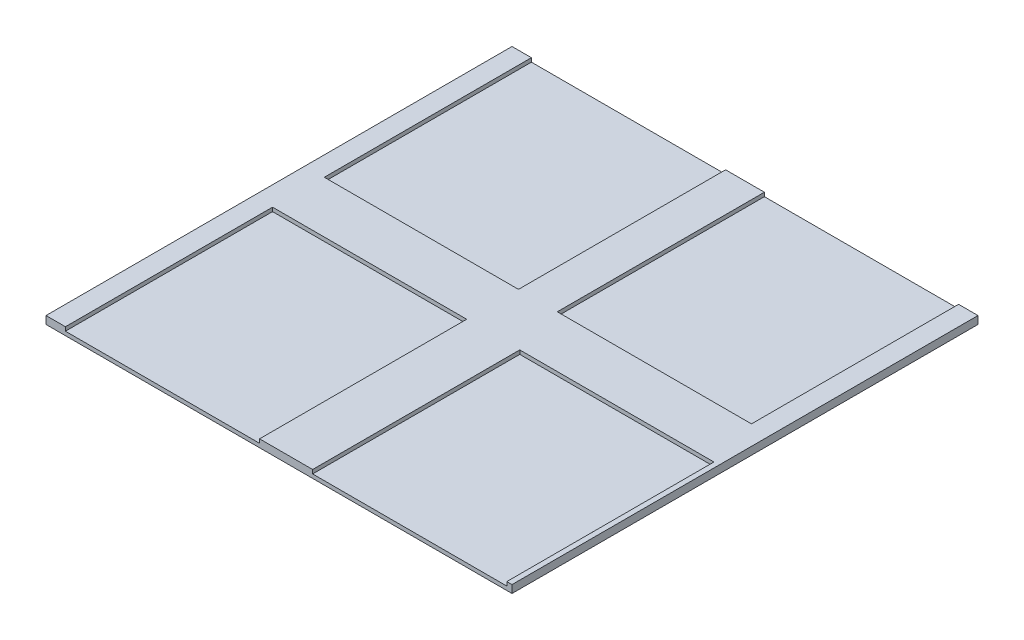
from build123d import *

# Parameters (mm, degrees)
SKETCH_1_W          = 360
SKETCH_1_H          = 360
EXTRUDE_1_DEPTH     = 6
SKETCH_2_W          = 140
SKETCH_2_H          = 140
CUT_EXTRUDE_1_DEPTH = 3
SKETCH_7_W          = 140
SKETCH_7_H          = 169.149624319
CUT_EXTRUDE_2_DEPTH = 110
SKETCH_4_R          = 42.212172728
EXTRUDE_2_DEPTH     = 1
SKETCH_10_W         = 6
SKETCH_10_H         = 160
CUT_EXTRUDE_3_DEPTH = 3
SKETCH_11_W         = 6
SKETCH_11_H         = 160
EXTRUDE_3_DEPTH     = 3
SKETCH_12_W         = 14
SKETCH_12_H         = 160
CUT_EXTRUDE_4_DEPTH = 3
SKETCH_13_W         = 14
SKETCH_13_H         = 160
EXTRUDE_4_DEPTH     = 3
SKETCH_14_W         = 4
SKETCH_14_H         = 160
EXTRUDE_5_DEPTH     = 3
SKETCH_15_W         = 4
SKETCH_15_H         = 160
CUT_EXTRUDE_5_DEPTH = 3
CUT_EXTRUDE_6_DEPTH = 3
SKETCH_17_W         = 150
SKETCH_17_H         = 165.602098182
CUT_EXTRUDE_7_DEPTH = 3


with BuildPart() as part:
    # 草图1 → 凸台-拉伸1 (new body)
    with BuildSketch(Plane(origin=(0, 0, 0), x_dir=(1, 0, 0), z_dir=(0, 1, 0))):
        Rectangle(SKETCH_1_W, SKETCH_1_H)
    extrude(amount=EXTRUDE_1_DEPTH)

    # 草图2 → 切除-拉伸1 (cut)
    with BuildSketch(Plane(origin=(0, 6, 0), x_dir=(1, 0, 0), z_dir=(0, 1, 0))):
        with Locations((-90, -90)):
            Rectangle(SKETCH_2_W, SKETCH_2_H)
        with Locations((90, -90)):
            Rectangle(SKETCH_2_W, SKETCH_2_H)
        with Locations((90, 90)):
            Rectangle(SKETCH_2_W, SKETCH_2_H)
        with Locations((-90, 90)):
            Rectangle(SKETCH_2_W, SKETCH_2_H)
    extrude(amount=-CUT_EXTRUDE_1_DEPTH, mode=Mode.SUBTRACT)

    # 草图7 → 切除-拉伸2 (cut)
    with BuildSketch(Plane(origin=(0, 3, 0), x_dir=(1, 0, 0), z_dir=(0, 1, 0))):
        with Locations((90, -104.57481216)):
            Rectangle(SKETCH_7_W, SKETCH_7_H)
        with Locations((-90, -104.57481216)):
            Rectangle(SKETCH_7_W, SKETCH_7_H)
        with Locations((90, 104.57481216)):
            Rectangle(SKETCH_7_W, SKETCH_7_H)
        with Locations((-90, 104.57481216)):
            Rectangle(SKETCH_7_W, SKETCH_7_H)
    extrude(amount=CUT_EXTRUDE_2_DEPTH, mode=Mode.SUBTRACT)

    # 草图4 → 凸台-拉伸2 (add)
    with BuildSketch(Plane.XZ):
        with Locations(Location((0, 0, 0), (0, 0, 270))):
            Circle(SKETCH_4_R)
    extrude(amount=EXTRUDE_2_DEPTH)

    # 草图10 → 切除-拉伸3 (cut)
    with BuildSketch(Plane(origin=(0, 6, 0), x_dir=(1, 0, 0), z_dir=(0, 1, 0))):
        with Locations((163, -100)):
            Rectangle(SKETCH_10_W, SKETCH_10_H)
    extrude(amount=-CUT_EXTRUDE_3_DEPTH, mode=Mode.SUBTRACT)

    # 草图11 → 凸台-拉伸3 (add)
    with BuildSketch(Plane(origin=(0, 6, 0), x_dir=(1, 0, 0), z_dir=(0, 1, 0))):
        with Locations((23, -100)):
            Rectangle(SKETCH_11_W, SKETCH_11_H)
    extrude(amount=-EXTRUDE_3_DEPTH)

    # 草图12 → 切除-拉伸4 (cut)
    with BuildSketch(Plane(origin=(0, 6, 0), x_dir=(1, 0, 0), z_dir=(0, 1, 0))):
        with Locations((173, -100)):
            Rectangle(SKETCH_12_W, SKETCH_12_H)
    extrude(amount=-CUT_EXTRUDE_4_DEPTH, mode=Mode.SUBTRACT)

    # 草图13 → 凸台-拉伸4 (add)
    with BuildSketch(Plane(origin=(0, 3, 0), x_dir=(1, 0, 0), z_dir=(0, 1, 0))):
        with Locations((33, -100)):
            Rectangle(SKETCH_13_W, SKETCH_13_H)
    extrude(amount=EXTRUDE_4_DEPTH)

    # 草图14 → 凸台-拉伸5 (add)
    with BuildSketch(Plane(origin=(0, 3, 0), x_dir=(1, 0, 0), z_dir=(0, 1, 0))):
        with Locations((178, -100)):
            Rectangle(SKETCH_14_W, SKETCH_14_H)
    extrude(amount=EXTRUDE_5_DEPTH)

    # 草图15 → 切除-拉伸5 (cut)
    with BuildSketch(Plane(origin=(0, 6, 0), x_dir=(1, 0, 0), z_dir=(0, 1, 0))):
        with Locations((38, -100)):
            Rectangle(SKETCH_15_W, SKETCH_15_H)
    extrude(amount=-CUT_EXTRUDE_5_DEPTH, mode=Mode.SUBTRACT)

    # 草图16 → 切除-拉伸6 (cut)
    with BuildSketch(Plane(origin=(0, 6, 0), x_dir=(1, 0, 0), z_dir=(0, 1, 0))):
        Polygon((-15, -170), (-15, -20), (-165, -20), (-165, -170), (-165, -206.201346441), (-15, -206.201346441), align=None)
        Polygon((-165, 170), (-165, 20), (-15, 20), (-15, 170), (-15, 194.423731299), (-165, 194.423731299), align=None)
        Polygon((15, 170), (15, 194.423731299), (165, 194.423731299), (165, 170), (165, 20), (15, 20), align=None)
    extrude(amount=-CUT_EXTRUDE_6_DEPTH, mode=Mode.SUBTRACT)

    # 草图17 → 切除-拉伸7 (cut)
    with BuildSketch(Plane(origin=(0, 6, 0), x_dir=(1, 0, 0), z_dir=(0, 1, 0))):
        with Locations((101, -102.801049091)):
            Rectangle(SKETCH_17_W, SKETCH_17_H)
    extrude(amount=-CUT_EXTRUDE_7_DEPTH, mode=Mode.SUBTRACT)


solid = part.part
